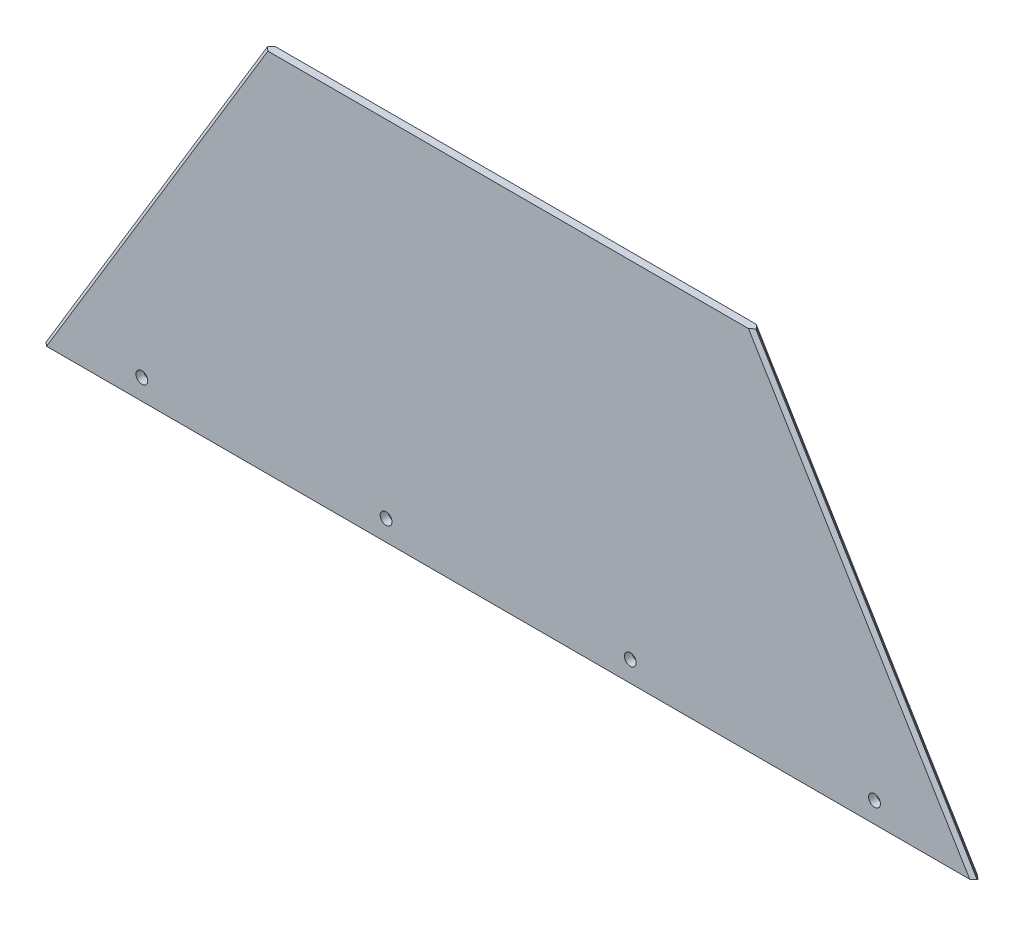
from build123d import *

# Parameters (mm, degrees)
EXTRUDE1_DEPTH               = 1.5875
CHAMFER1_SIZE                = 1.397
F_10_0_1935_DIAMETER_HOLE1_D = 4.9149
LPATTERN2_COUNT              = 3
LPATTERN2_PITCH              = 101.6
LPATTERN2_COL_COUNT          = 2
LPATTERN2_COL_PITCH          = 101.6


with BuildPart() as part:
    # Sketch1 → Extrude1 (new, symmetric)
    with BuildSketch(Plane.XY):
        Polygon((0, 0), (193.675, 0), (101.6, 152.4), (0, 152.4), (-101.6, 152.4), (-193.675, 0), align=None)
    extrude(amount=EXTRUDE1_DEPTH, both=True)

    # Chamfer1
    chamfer1_edges = [part.edges().sort_by_distance(p)[0] for p in [
        (147.6375, 76.2, 1.5875),
        (-147.6375, 76.2, 1.5875),
        (-147.6375, 76.2, -1.5875),
        (147.6375, 76.2, -1.5875),
    ]]
    chamfer(chamfer1_edges, length=CHAMFER1_SIZE)

    # #10 (0.1935) Diameter Hole1 (through all)
    with Locations(Plane(origin=(50.8, 8.5852, 1.5875), x_dir=(1, 0, 0), z_dir=(0, 0, 1))):
        with Locations((0, 0)):
            f_10_0_1935_diameter_hole1 = Hole(F_10_0_1935_DIAMETER_HOLE1_D / 2)

    # LPattern2: #10 (0.1935) Diameter Hole1 ×3
    with Locations(*[(-i * LPATTERN2_PITCH, 0, 0) for i in range(1, LPATTERN2_COUNT)]):
        add(f_10_0_1935_diameter_hole1, mode=Mode.SUBTRACT)

    # LPattern2 col: #10 (0.1935) Diameter Hole1 ×2
    with Locations(*[(i * LPATTERN2_COL_PITCH, 0, 0) for i in range(1, LPATTERN2_COL_COUNT)]):
        add(f_10_0_1935_diameter_hole1, mode=Mode.SUBTRACT)


solid = part.part
